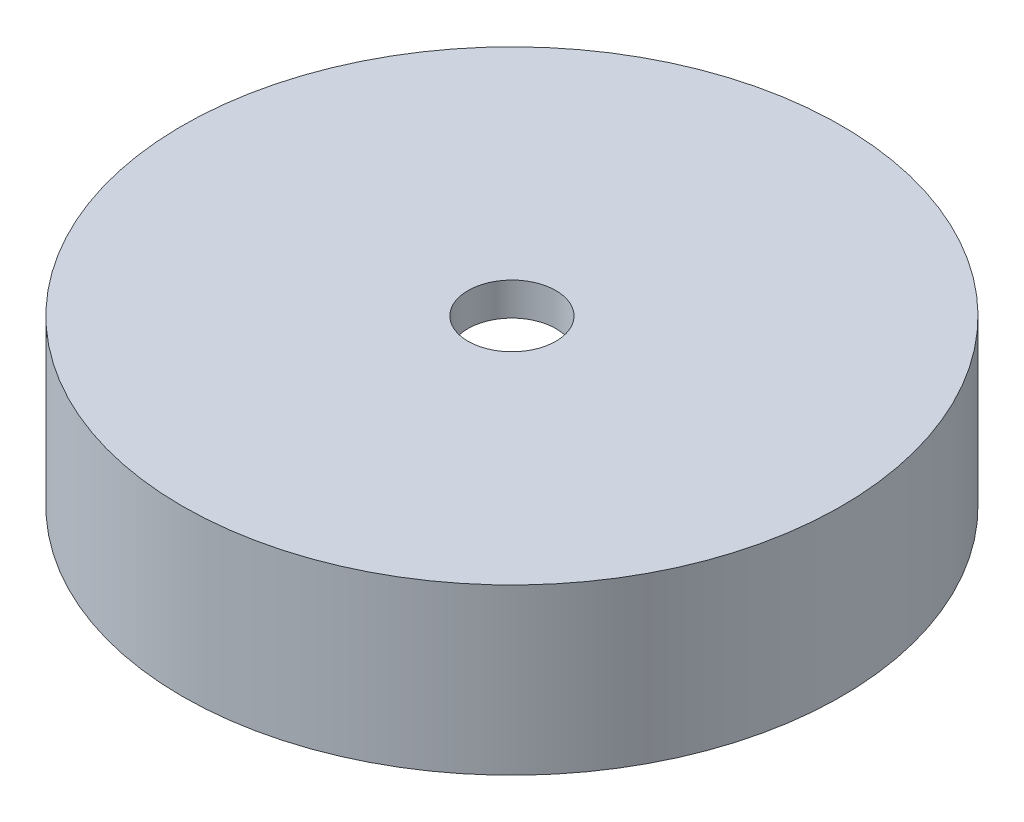
from build123d import *

# Parameters (mm, degrees)
SKETCH_1_R          = 30
EXTRUDE_1_DEPTH     = 15
SKETCH_2_R          = 25
CUT_EXTRUDE_1_DEPTH = 12
SKETCH_3_R          = 4
CUT_EXTRUDE_2_DEPTH = 61


with BuildPart() as part:
    # 草图1 → 凸台-拉伸1 (new body)
    with BuildSketch(Plane(origin=(0, 0, 0), x_dir=(1, 0, 0), z_dir=(0, 1, 0))):
        with Locations(Location((0, 0, 0), (0, 0, 270))):
            Circle(SKETCH_1_R)
    extrude(amount=EXTRUDE_1_DEPTH)

    # 草图2 → 切除-拉伸1 (cut)
    with BuildSketch(Plane(origin=(0, 0, 0), x_dir=(1, 0, 0), z_dir=(0, 1, 0))):
        with Locations(Location((0, 0, 0), (0, 0, 270))):
            Circle(SKETCH_2_R)
    extrude(amount=CUT_EXTRUDE_1_DEPTH, mode=Mode.SUBTRACT)

    # 草图3 → 切除-拉伸2 (cut, symmetric)
    with BuildSketch(Plane(origin=(0, 15, 0), x_dir=(1, 0, 0), z_dir=(0, 1, 0))):
        with Locations(Location((0, 0, 0), (0, 0, 270))):
            Circle(SKETCH_3_R)
    extrude(amount=CUT_EXTRUDE_2_DEPTH, both=True, mode=Mode.SUBTRACT)


solid = part.part
